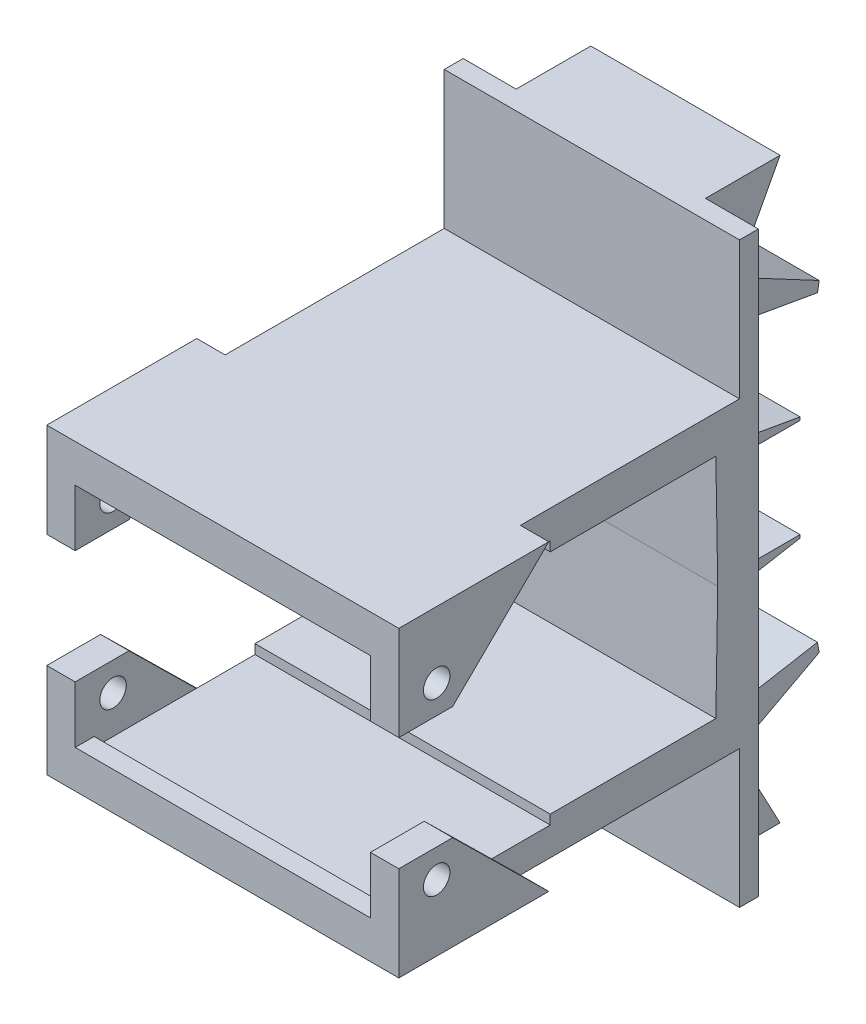
from build123d import *

# Parameters (mm, degrees)
EXTRUDE_1_DEPTH      = 2
EXTRUDE_1_DEPTH_BACK = 1
SKETCH_1_W           = 31.2
SKETCH_1_H           = 24
EXTRUDE_2_DEPTH      = 36
EXTRUDE_2_DEPTH_BACK = 3
SKETCH_2_W           = 31.2
SKETCH_2_H           = 4
SKETCH_3_R           = 1.4
EXTRUDE_3_DEPTH      = 3
SKETCH_4_R           = 1.4
CUT_EXTRUDE_1_DEPTH  = 8
SKETCH_5_W           = 17
SKETCH_5_H           = 1
CUT_EXTRUDE_2_DEPTH  = 31.2
CUT_EXTRUDE_3_DEPTH  = 31.2
EXTRUDE_START        = 2
SKETCH_7_R           = 1.4
EXTRUDE_4_DEPTH      = 2
EXTRUDE_5_DEPTH      = 10
EXTRUDE_5_DEPTH_BACK = 10
CUT_EXTRUDE_4_DEPTH  = 10


with BuildPart() as part:
    # 草图1 → 凸台-拉伸1 (new, two sides: drawn at the far end of the back side and taken through both)
    with BuildSketch(Plane.XY.offset(-EXTRUDE_1_DEPTH_BACK)):
        Rectangle(SKETCH_1_W, SKETCH_1_H)
    extrude(amount=EXTRUDE_1_DEPTH + EXTRUDE_1_DEPTH_BACK)

    # 草图2 → 凸台-拉伸2 (add, two sides: drawn at the far end of the back side and taken through both)
    with BuildSketch(Plane.XY.offset(2).offset(-EXTRUDE_2_DEPTH_BACK)):
        with Locations((0, 14)):
            Rectangle(SKETCH_2_W, SKETCH_2_H)
        with Locations((0, -14)):
            Rectangle(SKETCH_2_W, SKETCH_2_H)
    extrude(amount=EXTRUDE_2_DEPTH + EXTRUDE_2_DEPTH_BACK)

    # 草图3 → 凸台-拉伸3 (add)
    # profile 1 of 2: a face of its own
    with BuildSketch(Plane.ZY.offset(15.6)):
        Polygon((38, 16), (31, 16), (22.152932489, 16), (32.310715372, 6), (38, 6), align=None)
        with Locations((34, 9)):
            Circle(SKETCH_3_R, mode=Mode.SUBTRACT)
    # profile 2 of 2: a face of its own
    with BuildSketch(Plane.ZY.offset(15.6)):
        Polygon((38, -16), (38, -6), (32.310715372, -6), (22.152932489, -16), (31, -16), align=None)
        with Locations(Location((34, -9, 0), (0, 0, 180))):
            Circle(SKETCH_3_R, mode=Mode.SUBTRACT)
    extrude_3 = extrude(amount=EXTRUDE_3_DEPTH)

    # 草图4 → 切除-拉伸1 (cut)
    with BuildSketch(Plane(origin=(0, 0, -1), x_dir=(-1, 0, 0), z_dir=(0, 0, -1))):
        with Locations((13.6, -14)):
            Circle(SKETCH_4_R)
        with Locations(Location((13.6, 14, 0), (0, 0, 180))):
            Circle(SKETCH_4_R)
        with Locations(Location((-13.6, -14, 0), (0, 0, 180))):
            Circle(SKETCH_4_R)
        with Locations((-13.6, 14)):
            Circle(SKETCH_4_R)
    extrude(amount=-CUT_EXTRUDE_1_DEPTH, mode=Mode.SUBTRACT)

    # 镜向1: 凸台-拉伸3 across plane
    add(extrude_3.mirror(Plane(origin=(0, 0, 0), x_dir=(0, 0, 1), z_dir=(1, 0, 0))))

    # 草图5 → 切除-拉伸2 (cut)
    with BuildSketch(Plane.ZY.offset(15.6)):
        with Locations((27.5, 12.5)):
            Rectangle(SKETCH_5_W, SKETCH_5_H)
        with Locations((27.5, -12.5)):
            Rectangle(SKETCH_5_W, SKETCH_5_H)
    extrude(amount=-CUT_EXTRUDE_2_DEPTH, mode=Mode.SUBTRACT)

    # 草图6 → 切除-拉伸3 (cut)
    with BuildSketch(Plane.ZY.offset(15.6)):
        Polygon((1.3, 0), (1.5, 12), (2, 12), (2, -12), (1.5, -12), align=None)
    extrude(amount=-CUT_EXTRUDE_3_DEPTH, mode=Mode.SUBTRACT)

    # 草图7 → 凸台-拉伸4 (add)
    with BuildSketch(Plane(origin=(0, 0, -1), x_dir=(-1, 0, 0), z_dir=(0, 0, -1)).offset(EXTRUDE_START)):
        Polygon((-15.6, -16), (-15.6, 16), (-15.6, 36), (15.6, 36), (15.6, 16), (15.6, -16), (15.6, -36), (-15.6, -36), align=None)
        with Locations((-13.6, -14)):
            Circle(SKETCH_7_R, mode=Mode.SUBTRACT)
        with Locations((-13.6, 14)):
            Circle(SKETCH_7_R, mode=Mode.SUBTRACT)
        with Locations((13.6, 14)):
            Circle(SKETCH_7_R, mode=Mode.SUBTRACT)
        with Locations((13.6, -14)):
            Circle(SKETCH_7_R, mode=Mode.SUBTRACT)
    extrude(amount=-EXTRUDE_4_DEPTH)

    # 草图8 → 凸台-拉伸5 (add, two sides: drawn at the far end of the back side and taken through both)
    with BuildSketch(Plane(origin=(0, 0, 0), x_dir=(0, 0, -1), z_dir=(1, 0, 0)).offset(-EXTRUDE_5_DEPTH_BACK)):
        Polygon((6.193279754, 21.718771198), (10.887995382, 30.548247127), (3, 30.548247127), (3, 5.223875299), (13, 5.223875299), (13, 5.552438043), (3.15192247, 7.288919819), (4.992593153, 17.727882001), (14.840670683, 15.991400225), (15.022755683, 17.024055571), align=None)
        Polygon((10.887995382, -30.548247127), (3, -30.548247127), (3, -5.223875299), (13, -5.223875299), (13, -5.552438043), (3.15192247, -7.288919819), (4.992593153, -17.727882001), (14.840670683, -15.991400225), (15.022755683, -17.024055571), (6.193279754, -21.718771198), align=None)
    extrude(amount=EXTRUDE_5_DEPTH + EXTRUDE_5_DEPTH_BACK)

    # 草图9 → 切除-拉伸4 (cut)
    with BuildSketch(Plane(origin=(0, 0, -3), x_dir=(-1, 0, 0), z_dir=(0, 0, -1))):
        Polygon((15.6, 36), (-10, 36), (-15.6, 36), (-15.6, 30.548247127), (-10, 30.548247127), (15.6, 30.548247127), align=None)
        Polygon((15.6, -36), (-10, -36), (-15.6, -36), (-15.6, -30.548247127), (-10, -30.548247127), (15.6, -30.548247127), align=None)
    extrude(amount=-CUT_EXTRUDE_4_DEPTH, mode=Mode.SUBTRACT)


solid = part.part
